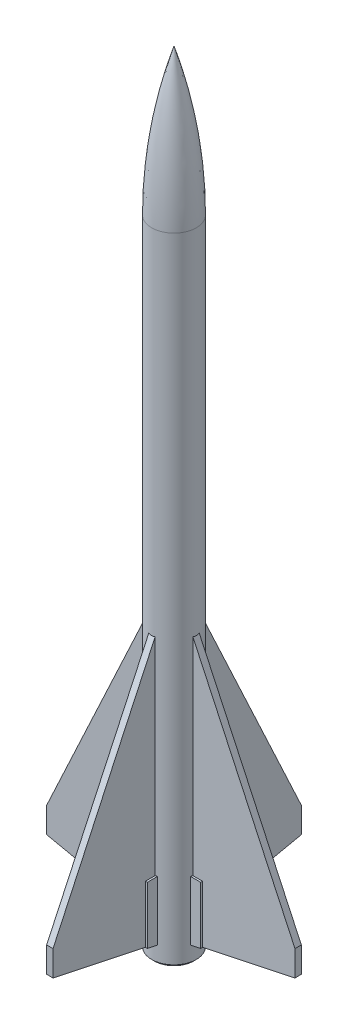
from build123d import *

# Parameters (mm, degrees)
SALIENTE_EXTRUIR1_DEPTH = 2.5
SALIENTE_EXTRUIR2_DEPTH = 4
MATRIZC2_COUNT          = 4
CHAFL_N1_SIZE           = 2


with BuildPart() as part:
    # Croquis2 → Revolución1 (revolve)
    with BuildSketch(Plane.XY):
        with BuildLine():
            Line((0, 0), (0, 615))
            ThreePointArc((0, 615), (13.099961221, 558.161950621), (17.5, 500))
            Line((17.5, 500), (17.5, 0))
            Line((17.5, 0), (0, 0))
        make_face()
    revolve(axis=Axis((0, 0, 0), (0, 1, 0)))

    # Croquis3 → Saliente-Extruir1 (add, symmetric)
    with BuildSketch(Plane.XY):
        Polygon((0, 10), (-97.579043475, 30.741065972), (-97.579043475, 50.741065972), (0, 260), align=None)
    saliente_extruir1 = extrude(amount=SALIENTE_EXTRUIR1_DEPTH, both=True)

    # Croquis4 → Saliente-Extruir2 (add, symmetric)
    with BuildSketch(Plane.XY):
        Polygon((-25, 15.313914042), (-25, 60.313914042), (0, 60.313914042), (0, 10), align=None)
    saliente_extruir2 = extrude(amount=SALIENTE_EXTRUIR2_DEPTH, both=True)

    # MatrizC2: Saliente-Extruir1, Saliente-Extruir2 ×4 about axis
    matrizc2_axis = Axis((0, 645.75, 0), (0, -1, 0))
    add([saliente_extruir1.rotate(matrizc2_axis, i * 360 / MATRIZC2_COUNT) for i in range(1, MATRIZC2_COUNT)])
    add([saliente_extruir2.rotate(matrizc2_axis, i * 360 / MATRIZC2_COUNT) for i in range(1, MATRIZC2_COUNT)])

    # Chaflán1
    chafl_n1_edges = [part.edges().sort_by_distance(p)[0] for p in [
        (-17.5, 0, 0),
    ]]
    chamfer(chafl_n1_edges, length=CHAFL_N1_SIZE)


solid = part.part
